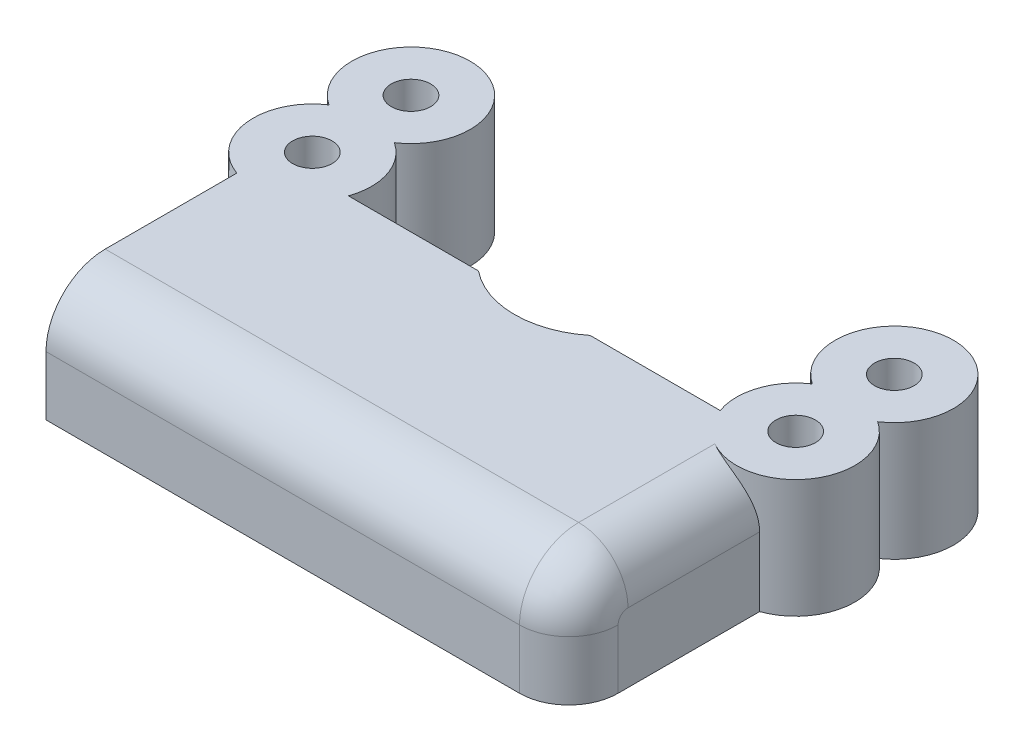
from build123d import *

# Parameters (mm, degrees)
SKETCH1_R             = 2.0000000000000036
SKETCH1_R_2           = 2.0000000000000213
BOSS_EXTRUDE1_DEPTH   = 10
SKETCH1_R_3           = 2.0000000000000013
BOSS_EXTRUDE1_2_DEPTH = 10
SKETCH2_W             = 53.000000000000014
SKETCH2_H             = 22.999999999999996
BOSS_EXTRUDE2_DEPTH   = 2
FILLET1_R             = 6
SKETCH5_R             = 5.999999999999998
SKETCH5_R_2           = 2
SKETCH5_R_3           = 2.0000000000000027
SKETCH5_R_4           = 6.000000000000003
SKETCH5_R_5           = 2.0000000000000067
SKETCH5_R_6           = 5.999999999999995
BOSS_EXTRUDE5_DEPTH   = 2
SKETCH7_R             = 9
CUT_EXTRUDE1_DEPTH    = 2
FILLET2_R             = 5


with BuildPart() as part:
    # Sketch1 → Boss-Extrude1 (new body)
    with BuildSketch(Plane(origin=(0, 0, 0), x_dir=(1, 0, 0), z_dir=(0, 1, 0))):
        with BuildLine():
            ThreePointArc((18.139184902589378, 6.828972817517872), (22.093910791670055, 11.750137196267254), (19.455809692945103, 17.48582706701017))
            ThreePointArc((19.455809692945035, 17.485827067010383), (16.139184902589513, 28.485827067010298), (12.82256011223399, 17.48582706701038))
            ThreePointArc((12.822560112233926, 17.485827067010174), (10.184459013508956, 11.75013719626737), (14.139184902589426, 6.8289728175179505))
            Line((14.139184902589509, 6.828972817517972), (14.139184902589509, -7.5458155744883015))
            Line((14.13918490258951, -7.545815574488302), (-34.86081509741051, -7.545815574488318))
            Line((-34.8608150974105, -7.545815574488319), (-34.8608150974105, -12.514172932989698))
            Line((-34.8608150974105, -12.5141729329897), (18.139184902589513, -12.514172932989684))
            Line((18.139184902589513, -12.514172932989686), (18.139184902589516, 6.828972817517839))
        make_face()
        with Locations(Location((16.139184902589513, 12.485827067010298, 0), (0, 0, 270))):
            Circle(SKETCH1_R, mode=Mode.SUBTRACT)
        with Locations(Location((16.139184902589513, 22.485827067010316, 0), (0, 0, 270))):
            Circle(SKETCH1_R_2, mode=Mode.SUBTRACT)
    extrude(amount=BOSS_EXTRUDE1_DEPTH)



with BuildPart() as body_2:
    # Sketch1 → Boss-Extrude1 2 (new body)
    with BuildSketch(Plane(origin=(0, 0, 0), x_dir=(1, 0, 0), z_dir=(0, 1, 0))):
        with BuildLine():
            ThreePointArc((-36.177439887766084, 17.48582706701017), (-32.860815097410494, 6.485827067010302), (-29.544190307054905, 17.485827067010174))
            ThreePointArc((-29.54419030705497, 17.485827067010383), (-32.86081509741049, 28.485827067010298), (-36.17743988776603, 17.48582706701039))
        make_face()
        with Locations(Location((-32.860815097410494, 12.485827067010298, 0), (0, 0, 270))):
            Circle(SKETCH1_R_3, mode=Mode.SUBTRACT)
        with Locations(Location((-32.860815097410494, 22.485827067010298, 0), (0, 0, 270))):
            Circle(SKETCH1_R, mode=Mode.SUBTRACT)
    extrude(amount=BOSS_EXTRUDE1_2_DEPTH)


with BuildPart() as part_1:
    add(part.part)

    add(body_2.part)  # Boss-Extrude2 merges body 2
    # Sketch2 → Boss-Extrude2 (add)
    with BuildSketch(Plane(origin=(0, 10, 0), x_dir=(1, 0, 0), z_dir=(0, 1, 0))):
        with Locations((-8.360815097410494, -1.0141729329897018)):
            Rectangle(SKETCH2_W, SKETCH2_H)
    extrude(amount=BOSS_EXTRUDE2_DEPTH)

    # Fillet1
    fillet1_edges = [part_1.edges().sort_by_distance(p)[0] for p in [
        (-8.360815097410494, 12, 12.5141729329897),
    ]]
    fillet(fillet1_edges, radius=FILLET1_R)

    # Sketch5 → Boss-Extrude5 (add)
    # profile 1 of 4: a face of its own
    with BuildSketch(Plane(origin=(0, 10, 0), x_dir=(1, 0, 0), z_dir=(0, 1, 0))):
        with Locations((16.139184902589513, 22.485827067010298)):
            Circle(SKETCH5_R)
        with Locations(Location((16.139184902589513, 22.485827067010298, 0), (0, 0, 270))):
            Circle(SKETCH5_R_2, mode=Mode.SUBTRACT)
    # profile 2 of 4: a face of its own
    with BuildSketch(Plane(origin=(0, 10, 0), x_dir=(1, 0, 0), z_dir=(0, 1, 0))):
        with Locations((16.139184902589513, 12.485827067010298)):
            Circle(SKETCH5_R)
        with Locations(Location((16.139184902589513, 12.485827067010298, 0), (0, 0, 270))):
            Circle(SKETCH5_R_3, mode=Mode.SUBTRACT)
    # profile 3 of 4: a face of its own
    with BuildSketch(Plane(origin=(0, 10, 0), x_dir=(1, 0, 0), z_dir=(0, 1, 0))):
        with Locations((-32.860815097410494, 22.485827067010298)):
            Circle(SKETCH5_R_4)
        with Locations(Location((-32.860815097410494, 22.485827067010298, 0), (0, 0, 270))):
            Circle(SKETCH5_R_5, mode=Mode.SUBTRACT)
    # profile 4 of 4: a face of its own
    with BuildSketch(Plane(origin=(0, 10, 0), x_dir=(1, 0, 0), z_dir=(0, 1, 0))):
        with Locations((-32.860815097410494, 12.4858270670103)):
            Circle(SKETCH5_R_6)
        with Locations(Location((-32.860815097410494, 12.4858270670103, 0), (0, 0, 270))):
            Circle(SKETCH5_R_3, mode=Mode.SUBTRACT)
    extrude(amount=BOSS_EXTRUDE5_DEPTH)

    # Sketch7 → Cut-Extrude1 (cut)
    with BuildSketch(Plane(origin=(0, 12, 0), x_dir=(1, 0, 0), z_dir=(0, 1, 0))):
        with Locations((-8.360815097410491, 17.485827067010298)):
            Circle(SKETCH7_R)
    extrude(amount=-CUT_EXTRUDE1_DEPTH, mode=Mode.SUBTRACT)

    # Fillet2
    fillet2_edges = [part_1.edges().sort_by_distance(p)[0] for p in [
        (18.139184902589513, 12, -0.1573999422640835),
        (18.139184902589513, 3.0000000000000004, 12.514172932989688),
        (18.139184902589513, 10.242640687119287, 10.756813620108982),
    ]]
    fillet(fillet2_edges, radius=FILLET2_R)


solid = part_1.part
